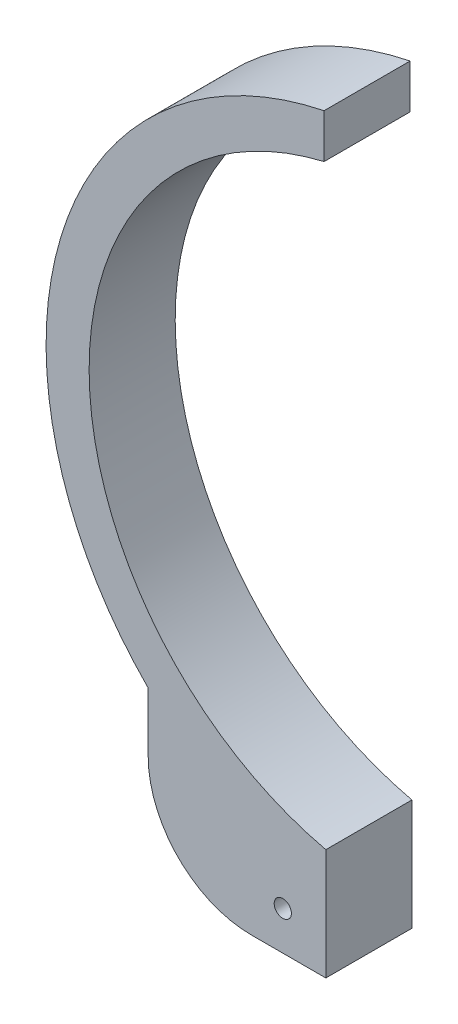
from build123d import *

# Parameters (mm, degrees)
SKETCH1_R           = 1
BOSS_EXTRUDE1_DEPTH = 10
SKETCH2_W           = 8.204002356
SKETCH2_H           = 9.353246275
CUT_EXTRUDE1_DEPTH  = 10


with BuildPart() as part:
    # Sketch1 → Boss-Extrude1 (new body)
    with BuildSketch(Plane.XY):
        with BuildLine():
            ThreePointArc((-8, -34.586847211), (-35.270973023, 4.025973423), (0, 35.5))
            Line((0, 35.5), (0, 40.5))
            ThreePointArc((0, 40.5), (-37.417121067, 15.498679011), (-28.637824638, -28.637824638))
            Line((-28.637824638, -28.637824638), (-28.637824638, -35.5))
            ThreePointArc((-28.637824638, -35.5), (-25.123106012, -43.985281374), (-16.637824638, -47.5))
            Line((-16.637824638, -47.5), (-8, -47.5))
            Line((-8, -47.5), (-8, -34.586847211))
        make_face()
        with Locations((-13, -42.999876828)):
            Circle(SKETCH1_R, mode=Mode.SUBTRACT)
    extrude(amount=BOSS_EXTRUDE1_DEPTH)

    # Sketch2 → Cut-Extrude1 (cut)
    with BuildSketch(Plane.XY.offset(10)):
        with Locations((-4.102001178, 35.823376862)):
            Rectangle(SKETCH2_W, SKETCH2_H)
    extrude(amount=-CUT_EXTRUDE1_DEPTH, mode=Mode.SUBTRACT)


solid = part.part
